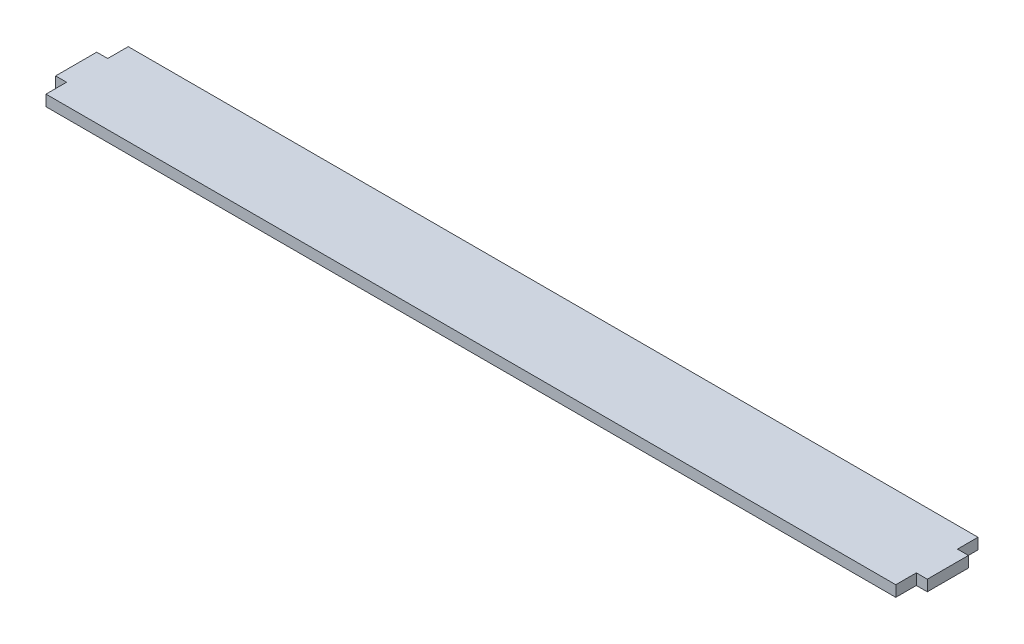
from build123d import *

# Parameters (mm, degrees)
SCHIZZO1_W                   = 310
SCHIZZO1_H                   = 30
SCHIZZO1_W_2                 = 4
SCHIZZO1_H_2                 = 15
ESTRUSIONE_ESTRUSIONE1_DEPTH = 4


with BuildPart() as part:
    # Schizzo1 → Estrusione-Estrusione1 (new body)
    with BuildSketch(Plane(origin=(0, 0, 0), x_dir=(1, 0, 0), z_dir=(0, 1, 0))):
        Rectangle(SCHIZZO1_W, SCHIZZO1_H)
        with Locations((-157, 0)):
            Rectangle(SCHIZZO1_W_2, SCHIZZO1_H_2)
        with Locations((157, 0)):
            Rectangle(SCHIZZO1_W_2, SCHIZZO1_H_2)
    extrude(amount=ESTRUSIONE_ESTRUSIONE1_DEPTH)


solid = part.part
